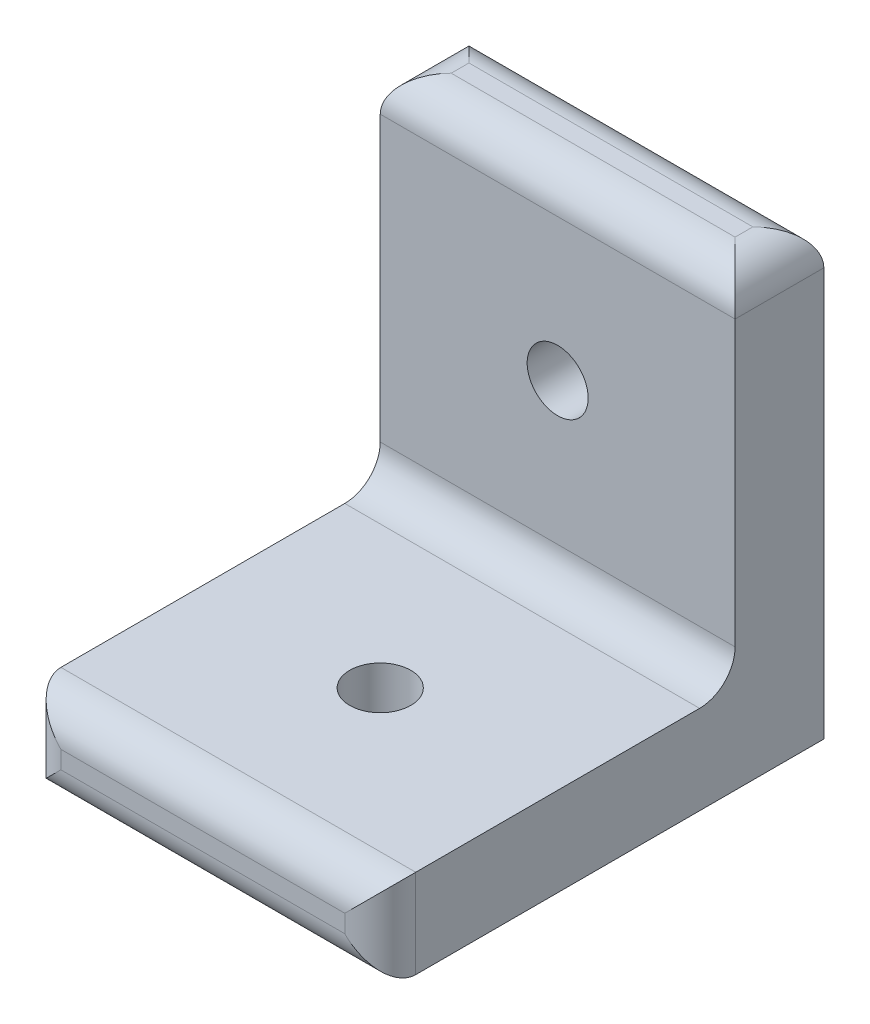
from build123d import *

# Parameters (mm, degrees)
SKETCH1_W                        = 25.4
SKETCH1_H                        = 25.4
BOSS_EXTRUDE1_DEPTH              = 6.35
SKETCH2_W                        = 25.4
SKETCH2_H                        = 31.75
BOSS_EXTRUDE2_DEPTH              = 6.35
FILLET1_R                        = 2.54
F_11_64_0_17188_DIAMETER_HOLE1_D = 4.365752
F_11_64_0_17188_DIAMETER_HOLE2_D = 4.365752


with BuildPart() as part:
    # Sketch1 → Boss-Extrude1 (new body)
    with BuildSketch(Plane(origin=(0, 0, 0), x_dir=(1, 0, 0), z_dir=(0, 1, 0))):
        Rectangle(SKETCH1_W, SKETCH1_H)
    extrude(amount=BOSS_EXTRUDE1_DEPTH)

    # Sketch2 → Boss-Extrude2 (add)
    with BuildSketch(Plane(origin=(0, 0, -12.7), x_dir=(-1, 0, 0), z_dir=(0, 0, -1))):
        with Locations((0, 15.875)):
            Rectangle(SKETCH2_W, SKETCH2_H)
    extrude(amount=BOSS_EXTRUDE2_DEPTH)

    # Fillet1
    fillet1_edges = [part.edges().sort_by_distance(p)[0] for p in [
        (0, 31.75, -12.7),
        (-12.7, 31.75, -15.875),
        (12.7, 31.75, -15.875),
        (0, 6.35, 12.7),
        (0, 31.75, -19.05),
        (0, 0, 12.7),
        (12.7, 3.175, 12.7),
        (-12.7, 3.175, 12.7),
        (0, 6.35, -12.7),
    ]]
    fillet(fillet1_edges, radius=FILLET1_R)

    # 11/64 (0.17188) Diameter Hole1 (through all)
    with Locations(Plane(origin=(0, 6.35, 0), x_dir=(1, 0, 0), z_dir=(0, 1, 0))):
        with Locations((0, 0)):
            Hole(F_11_64_0_17188_DIAMETER_HOLE1_D / 2)

    # 11/64 (0.17188) Diameter Hole2 (through all)
    with Locations(Plane.XY.offset(-12.7)):
        with Locations((0, 19.05)):
            Hole(F_11_64_0_17188_DIAMETER_HOLE2_D / 2)


solid = part.part
